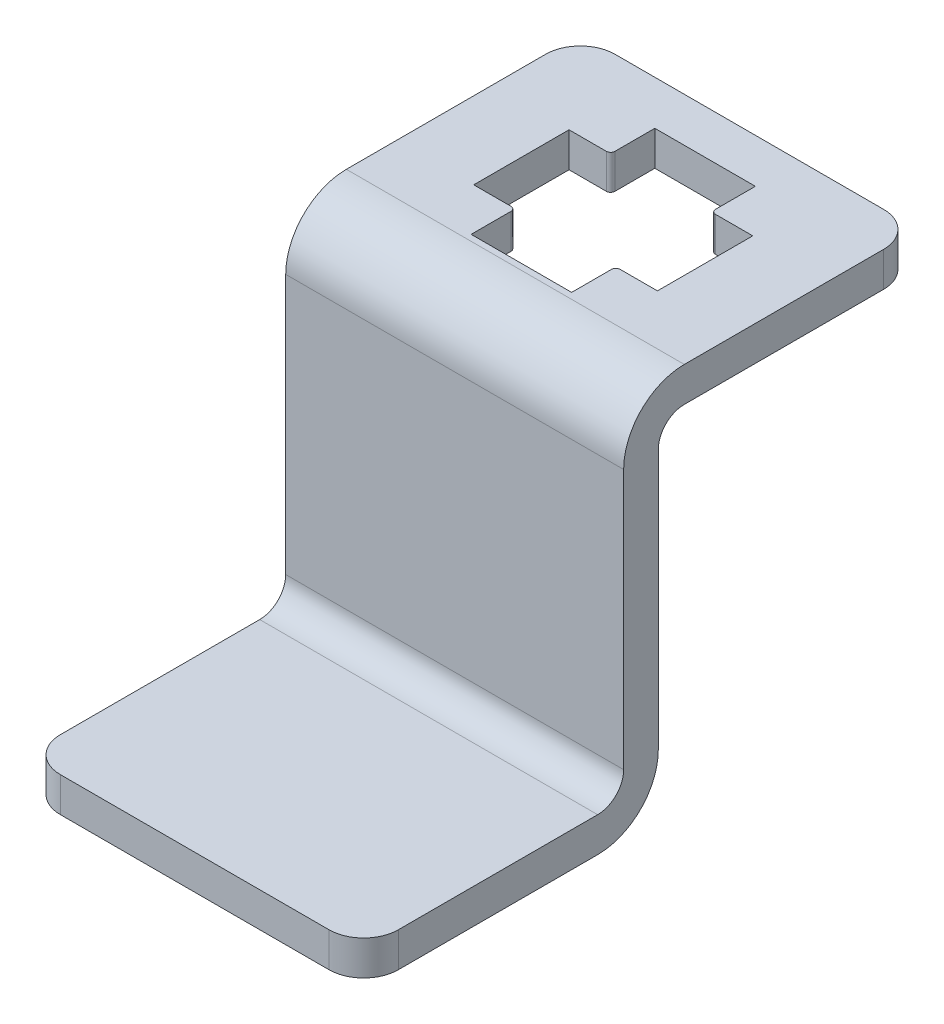
from build123d import *

# Parameters (mm, degrees)
EXTRUDE_THIN1_DEPTH = 9.75
CUT_EXTRUDE1_DEPTH  = 2
FILLET2_R           = 2


with BuildPart() as part:
    # Sketch1 → Extrude-Thin1 (new, symmetric)
    with BuildSketch(Plane(origin=(0, 0, 0), x_dir=(0, 0, -1), z_dir=(1, 0, 0))):
        with BuildLine():
            Line((0, 0), (13.5, 0))
            ThreePointArc((13.5, 0), (14.560660172, 0.439339828), (15, 1.5))
            Line((15, 1.5), (15, 16.5))
            ThreePointArc((15, 16.5), (16.025126266, 18.974873734), (18.5, 20))
            Line((18.5, 20), (32, 20))
            Line((32, 20), (32, 18))
            Line((32, 18), (18.5, 18))
            ThreePointArc((18.5, 18), (17.439339828, 17.560660172), (17, 16.5))
            Line((17, 16.5), (17, 1.5))
            ThreePointArc((17, 1.5), (15.974873734, -0.974873734), (13.5, -2))
            Line((13.5, -2), (0, -2))
            Line((0, -2), (0, 0))
        make_face()
    extrude(amount=EXTRUDE_THIN1_DEPTH, both=True)

    # Sketch2 → Cut-Extrude1 (cut)
    with BuildSketch(Plane(origin=(0, 20, 0), x_dir=(1, 0, 0), z_dir=(0, 1, 0))):
        with BuildLine():
            Line((-2.9, 29.45), (2.9, 29.45))
            Line((2.9, 29.45), (2.9, 27.15))
            ThreePointArc((2.9, 27.15), (2.973223305, 26.973223305), (3.15, 26.9))
            Line((3.15, 26.9), (5.3, 26.9))
            Line((5.3, 26.9), (5.3, 21.4))
            Line((5.3, 21.4), (3.15, 21.4))
            ThreePointArc((3.15, 21.4), (2.973223305, 21.326776695), (2.9, 21.15))
            Line((2.9, 21.15), (2.9, 18.85))
            Line((2.9, 18.85), (-2.9, 18.85))
            Line((-2.9, 18.85), (-2.9, 21.15))
            ThreePointArc((-2.9, 21.15), (-2.973223305, 21.326776695), (-3.15, 21.4))
            Line((-3.15, 21.4), (-5.3, 21.4))
            Line((-5.3, 21.4), (-5.3, 26.9))
            Line((-5.3, 26.9), (-3.15, 26.9))
            ThreePointArc((-3.15, 26.9), (-2.973223305, 26.973223305), (-2.9, 27.15))
            Line((-2.9, 27.15), (-2.9, 29.45))
        make_face()
    extrude(amount=-CUT_EXTRUDE1_DEPTH, mode=Mode.SUBTRACT)

    # Fillet2
    fillet2_edges = [part.edges().sort_by_distance(p)[0] for p in [
        (-9.75, -1, 0),
        (-9.75, 19, -32),
        (9.75, -1, 0),
        (9.75, 19, -32),
    ]]
    fillet(fillet2_edges, radius=FILLET2_R)


solid = part.part
